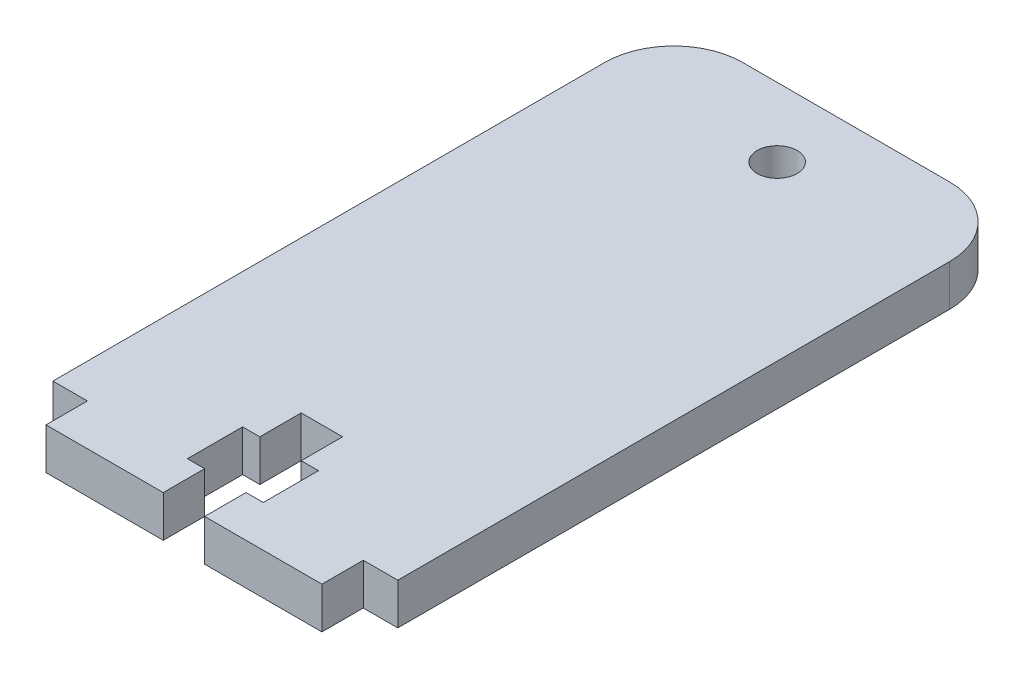
from build123d import *

# Parameters (mm, degrees)
SKETCH_1_R      = 1.45
EXTRUDE_1_DEPTH = 3


with BuildPart() as part:
    # 草图1 → 凸台-拉伸1 (new body)
    # profile 1 of 3: a face of its own
    with BuildSketch(Plane(origin=(0, 0, 0), x_dir=(1, 0, 0), z_dir=(0, 1, 0))):
        with BuildLine():
            Line((20, 0), (5, 0))
            ThreePointArc((5, 0), (1.464466094, -1.464466094), (0, -5))
            Line((0, -5), (0, -45))
            Line((0, -45), (2.5, -45))
            Line((2.5, -45), (9.75, -45))
            Line((9.75, -45), (9.75, -41))
            Line((9.75, -41), (11, -41))
            Line((11, -41), (11, -38))
            Line((11, -38), (14, -38))
            Line((14, -38), (14, -41))
            Line((14, -41), (15.25, -41))
            Line((15.25, -41), (15.25, -45))
            Line((15.25, -45), (22.5, -45))
            Line((22.5, -45), (25, -45))
            Line((25, -45), (25, -5))
            ThreePointArc((25, -5), (23.535533906, -1.464466094), (20, 0))
        make_face()
        with Locations(Location((12.5, -5, 0), (0, 0, 270))):
            Circle(SKETCH_1_R, mode=Mode.SUBTRACT)
    # profile 2 of 3: a face of its own
    with BuildSketch(Plane(origin=(0, 0, 0), x_dir=(1, 0, 0), z_dir=(0, 1, 0))):
        Polygon((22.5, -48), (22.5, -45), (15.25, -45), (14, -45), (14, -48), align=None)
    # profile 3 of 3: a face of its own
    with BuildSketch(Plane(origin=(0, 0, 0), x_dir=(1, 0, 0), z_dir=(0, 1, 0))):
        Polygon((9.75, -45), (2.5, -45), (2.5, -48), (11, -48), (11, -45), align=None)
    extrude(amount=EXTRUDE_1_DEPTH)


solid = part.part
